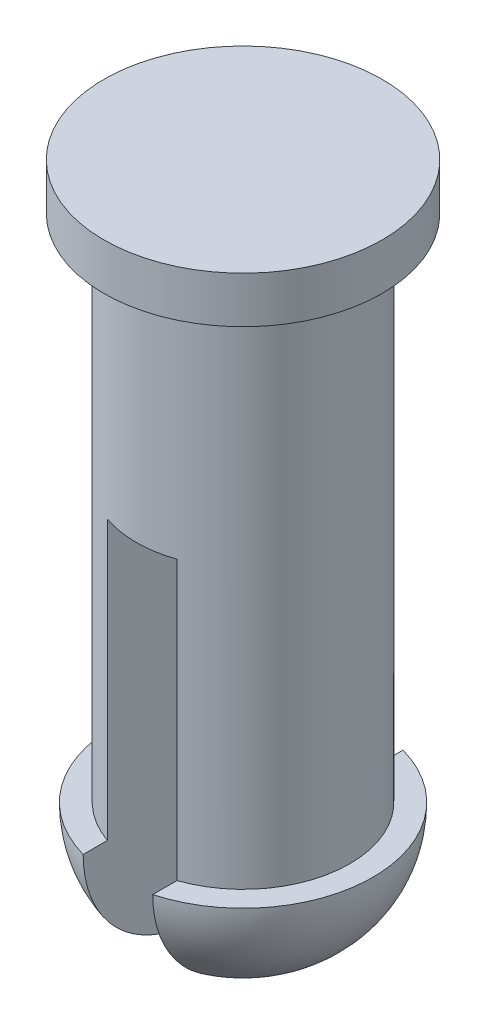
from build123d import *

# Parameters (mm, degrees)
CUT_EXTRUDE11_DEPTH = 1.27


with BuildPart() as part:
    # Sketch1 → Revolve1 (revolve)
    with BuildSketch(Plane.XY):
        with BuildLine():
            Line((0, 0), (0, 3.048))
            Line((0, 3.048), (0.762, 3.048))
            Line((0.762, 3.048), (0.762, 2.794))
            Line((0.762, 2.794), (0.5842, 2.794))
            Line((0.5842, 2.794), (0.5842, 0))
            Line((0.5842, 0), (0.7112, 0))
            ThreePointArc((0.7112, 0), (0.497756642, -0.476715439), (0, -0.635))
            Line((0, -0.635), (0, 0))
        make_face()
    revolve(axis=Axis((0, -1000, 0), (0, 1, 0)))

    # Sketch4 → Cut-Extrude11 (cut, symmetric)
    with BuildSketch(Plane.XY):
        Polygon((-0.1905, 0), (-0.1905, 1.524), (0.1905, 1.524), (0.1905, -0.6604), (-0.1905, -0.6604), align=None)
    extrude(amount=CUT_EXTRUDE11_DEPTH, both=True, mode=Mode.SUBTRACT)


solid = part.part
